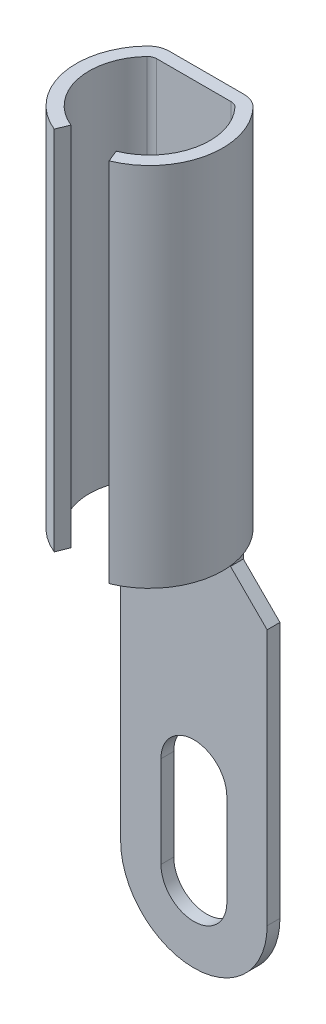
from build123d import *

# Parameters (mm, degrees)
EXTRUDE_THIN1_DEPTH = 10
EXTRUDE1_DEPTH      = 0.35


with BuildPart() as part:
    # Sketch1 → Extrude-Thin1 (new body)
    with BuildSketch(Plane(origin=(0, 0, 0), x_dir=(1, 0, 0), z_dir=(0, 1, 0))):
        with BuildLine():
            ThreePointArc((-0.75, -1.854049622), (-1.954040628, -0.426292414), (-1.454057939, 1.373213571))
            ThreePointArc((-1.454057939, 1.373213571), (-1.255350091, 1.512238811), (-1.017840557, 1.5612495))
            Line((-1.017840557, 1.5612495), (1.017840557, 1.5612495))
            ThreePointArc((1.017840557, 1.5612495), (1.255350091, 1.512238811), (1.454057939, 1.373213571))
            ThreePointArc((1.454057939, 1.373213571), (1.954040628, -0.426292414), (0.75, -1.854049622))
            Line((0.75, -1.854049622), (0.61875, -1.529590938))
            ThreePointArc((0.61875, -1.529590938), (1.612083519, -0.351691242), (1.199597799, 1.132901196))
            ThreePointArc((1.199597799, 1.132901196), (1.116802863, 1.190828379), (1.017840557, 1.2112495))
            Line((1.017840557, 1.2112495), (-1.017840557, 1.2112495))
            ThreePointArc((-1.017840557, 1.2112495), (-1.116802863, 1.190828379), (-1.199597799, 1.132901196))
            ThreePointArc((-1.199597799, 1.132901196), (-1.612083519, -0.351691242), (-0.61875, -1.529590938))
            Line((-0.61875, -1.529590938), (-0.75, -1.854049622))
        make_face()
    extrude(amount=EXTRUDE_THIN1_DEPTH)

    # Sketch2 → Extrude1 (add)
    with BuildSketch(Plane.XY.offset(-1.2112495)):
        with BuildLine():
            Line((-1, 0), (-1, -1))
            Line((-1, -1), (-2, -2))
            Line((-2, -2), (-2, -9))
            ThreePointArc((-2, -9), (0, -11), (2, -9))
            Line((2, -9), (2, -2))
            Line((2, -2), (1, -1))
            Line((1, -1), (1, 0))
            Line((1, 0), (-1, 0))
        make_face()
        with BuildLine():
            Line((0.9, -9), (0.9, -6.5))
            ThreePointArc((0.9, -6.5), (0, -5.6), (-0.9, -6.5))
            Line((-0.9, -6.5), (-0.9, -9))
            ThreePointArc((-0.9, -9), (0, -9.9), (0.9, -9))
        make_face(mode=Mode.SUBTRACT)
    extrude(amount=-EXTRUDE1_DEPTH)


solid = part.part
